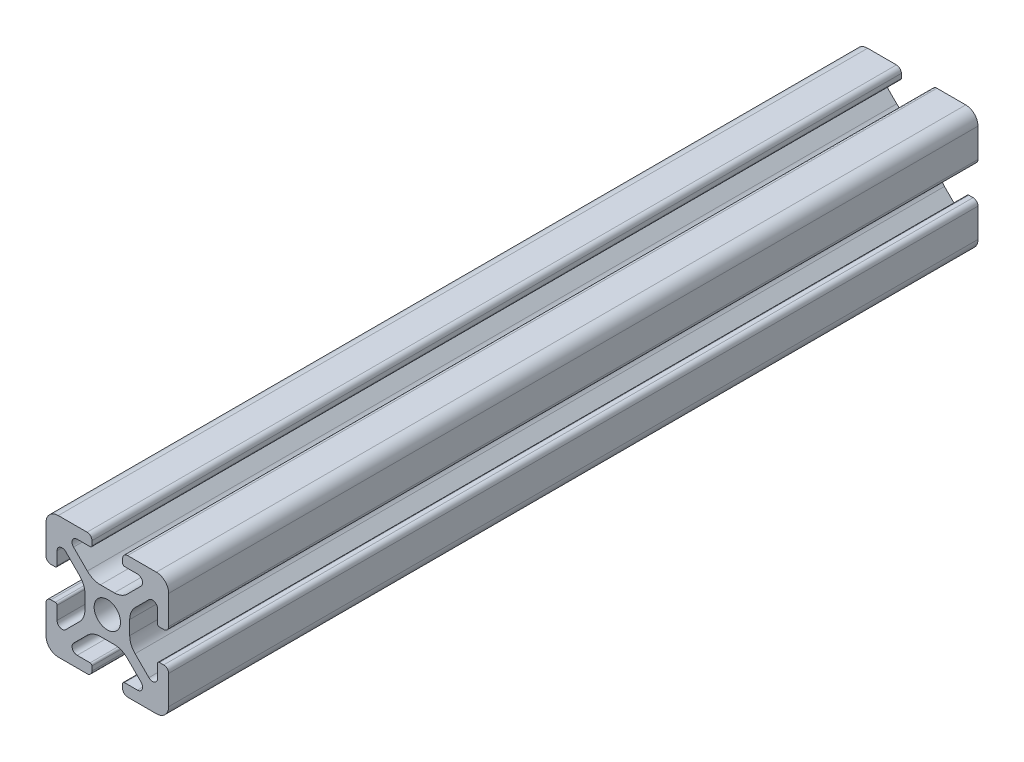
from build123d import *

# Parameters (mm, degrees)
BOSS_EXTRU_1_DEPTH = 132


with BuildPart() as part:
    # Esquisse1 → Boss.-Extru.1 (new body)
    with BuildSketch(Plane.XY):
        with BuildLine():
            Line((-3.255887446, 4.528679645), (-5.506192286, 6.778984485))
            ThreePointArc((-5.506192286, 6.778984485), (-5.686636441, 7.686138511), (-4.917588391, 8.199999989))
            Line((-4.917588391, 8.199999989), (-2.799999991, 8.199999989))
            ThreePointArc((-2.799999991, 8.199999989), (-2.587867957, 8.287867955), (-2.499999991, 8.499999989))
            Line((-2.499999991, 8.499999989), (-2.499999991, 9.199999989))
            ThreePointArc((-2.499999991, 9.199999989), (-2.734314566, 9.765685414), (-3.299999991, 9.999999989))
            Line((-3.299999991, 9.999999989), (-7.999999991, 9.999999989))
            ThreePointArc((-7.999999991, 9.999999989), (-9.414213554, 9.414213552), (-9.999999991, 7.999999989))
            Line((-9.999999991, 7.999999989), (-9.999999991, 3.299999989))
            ThreePointArc((-9.999999991, 3.299999989), (-9.765685416, 2.734314564), (-9.199999991, 2.499999989))
            Line((-9.199999991, 2.499999989), (-8.499999991, 2.499999989))
            ThreePointArc((-8.499999991, 2.499999989), (-8.287867957, 2.587867955), (-8.199999991, 2.799999989))
            Line((-8.199999991, 2.799999989), (-8.199999991, 4.917588389))
            ThreePointArc((-8.199999991, 4.917588389), (-7.686138517, 5.686636433), (-6.778984497, 5.506192279))
            Line((-6.778984497, 5.506192279), (-4.528679657, 3.255887439))
            ThreePointArc((-4.528679657, 3.255887439), (-3.878361403, 2.282617393), (-3.650000001, 1.134567096))
            Line((-3.650000001, 1.134567096), (-3.650000001, -1.134567114))
            ThreePointArc((-3.650000001, -1.134567114), (-3.878361403, -2.282617409), (-4.528679656, -3.255887454))
            Line((-4.528679656, -3.255887454), (-6.778984496, -5.506192294))
            ThreePointArc((-6.778984496, -5.506192294), (-7.686138522, -5.686636449), (-8.2, -4.9175884))
            Line((-8.2, -4.9175884), (-8.2, -2.8))
            ThreePointArc((-8.2, -2.8), (-8.287867966, -2.587867966), (-8.5, -2.5))
            Line((-8.5, -2.5), (-9.2, -2.5))
            ThreePointArc((-9.2, -2.5), (-9.765685425, -2.734314575), (-10, -3.3))
            Line((-10, -3.3), (-10, -8))
            ThreePointArc((-10, -8), (-9.414213562, -9.414213562), (-8, -10))
            Line((-8, -10), (-3.3, -10))
            ThreePointArc((-3.3, -10), (-2.734314575, -9.765685425), (-2.5, -9.2))
            Line((-2.5, -9.2), (-2.5, -8.5))
            ThreePointArc((-2.5, -8.5), (-2.587867966, -8.287867966), (-2.8, -8.2))
            Line((-2.8, -8.2), (-4.9175884, -8.2))
            ThreePointArc((-4.9175884, -8.2), (-5.686636444, -7.686138526), (-5.50619229, -6.778984506))
            Line((-5.50619229, -6.778984506), (-3.25588745, -4.528679666))
            ThreePointArc((-3.25588745, -4.528679666), (-2.282617404, -3.878361412), (-1.134567106, -3.650000009))
            Line((-1.134567106, -3.650000009), (1.134567104, -3.650000009))
            ThreePointArc((1.134567104, -3.650000009), (2.282617399, -3.878361412), (3.255887444, -4.528679664))
            Line((3.255887444, -4.528679664), (5.506192284, -6.778984504))
            ThreePointArc((5.506192284, -6.778984504), (5.686636439, -7.686138531), (4.917588389, -8.200000009))
            Line((4.917588389, -8.200000009), (2.799999989, -8.200000009))
            ThreePointArc((2.799999989, -8.200000009), (2.587867955, -8.287867974), (2.499999989, -8.500000009))
            Line((2.499999989, -8.500000009), (2.499999989, -9.200000009))
            ThreePointArc((2.499999989, -9.200000009), (2.734314564, -9.765685434), (3.299999989, -10.000000009))
            Line((3.299999989, -10.000000009), (7.999999989, -10.000000009))
            ThreePointArc((7.999999989, -10.000000009), (9.414213552, -9.414213571), (9.999999989, -8.000000009))
            Line((9.999999989, -8.000000009), (9.999999989, -3.300000009))
            ThreePointArc((9.999999989, -3.300000009), (9.765685414, -2.734314584), (9.199999989, -2.500000009))
            Line((9.199999989, -2.500000009), (8.499999989, -2.500000009))
            ThreePointArc((8.499999989, -2.500000009), (8.287867955, -2.587867974), (8.199999989, -2.800000009))
            Line((8.199999989, -2.800000009), (8.199999989, -4.917588409))
            ThreePointArc((8.199999989, -4.917588409), (7.686138515, -5.686636452), (6.778984495, -5.506192299))
            Line((6.778984495, -5.506192299), (4.528679655, -3.255887459))
            ThreePointArc((4.528679655, -3.255887459), (3.878361401, -2.282617412), (3.649999999, -1.134567115))
            Line((3.649999999, -1.134567115), (3.649999999, 1.134567095))
            ThreePointArc((3.649999999, 1.134567095), (3.878361401, 2.28261739), (4.528679654, 3.255887435))
            Line((4.528679654, 3.255887435), (6.778984494, 5.506192275))
            ThreePointArc((6.778984494, 5.506192275), (7.68613852, 5.68663643), (8.199999998, 4.917588381))
            Line((8.199999998, 4.917588381), (8.199999998, 2.799999981))
            ThreePointArc((8.199999998, 2.799999981), (8.287867964, 2.587867946), (8.499999998, 2.499999981))
            Line((8.499999998, 2.499999981), (9.199999998, 2.499999981))
            ThreePointArc((9.199999998, 2.499999981), (9.765685423, 2.734314556), (9.999999998, 3.299999981))
            Line((9.999999998, 3.299999981), (9.999999998, 7.999999981))
            ThreePointArc((9.999999998, 7.999999981), (9.41421356, 9.414213543), (7.999999998, 9.999999981))
            Line((7.999999998, 9.999999981), (3.299999998, 9.999999981))
            ThreePointArc((3.299999998, 9.999999981), (2.734314573, 9.765685406), (2.499999998, 9.199999981))
            Line((2.499999998, 9.199999981), (2.499999998, 8.499999981))
            ThreePointArc((2.499999998, 8.499999981), (2.587867964, 8.287867946), (2.799999998, 8.199999981))
            Line((2.799999998, 8.199999981), (4.917588398, 8.199999981))
            ThreePointArc((4.917588398, 8.199999981), (5.686636442, 7.686138507), (5.506192288, 6.778984487))
            Line((5.506192288, 6.778984487), (3.255887448, 4.528679647))
            ThreePointArc((3.255887448, 4.528679647), (2.282617402, 3.878361393), (1.134567104, 3.64999999))
            Line((1.134567104, 3.64999999), (-1.134567106, 3.64999999))
            ThreePointArc((-1.134567106, 3.64999999), (-2.282617401, 3.878361392), (-3.255887446, 4.528679645))
        make_face()
        with BuildLine():
            ThreePointArc((-2.15, 0), (0, -2.15), (2.15, 0))
            ThreePointArc((2.15, 0), (0, 2.15), (-2.15, 0))
        make_face(mode=Mode.SUBTRACT)
    extrude(amount=BOSS_EXTRU_1_DEPTH)


solid = part.part
